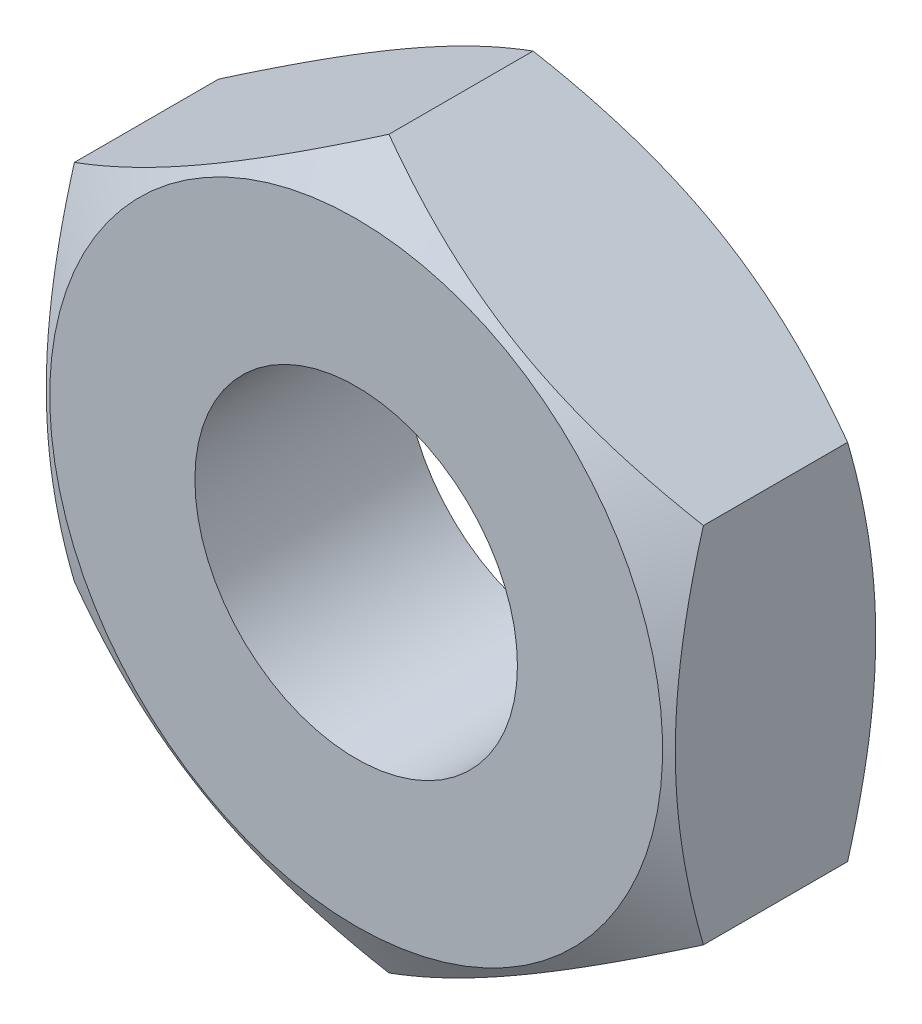
from build123d import *

# Parameters (mm, degrees)
SKETCH1_R      = 1
EXTRUDE1_DEPTH = 1.3


with BuildPart() as part:
    # Sketch1 → Extrude1 (new body)
    with BuildSketch(Plane.XY):
        Polygon((0, 2.25166605), (-1.95, 1.125833025), (-1.95, -1.125833025), (0, -2.25166605), (1.95, -1.125833025), (1.95, 1.125833025), align=None)
        Circle(SKETCH1_R, mode=Mode.SUBTRACT)
    extrude(amount=EXTRUDE1_DEPTH)

    # Sketch2 → Cut-Revolve1 (revolve, cut)
    with BuildSketch(Plane(origin=(0, 0, 0), x_dir=(0, 0, -1), z_dir=(1, 0, 0)), mode=Mode.PRIVATE) as cut_revolve1_sk:
        Polygon((-1.3, 1.9), (-0.865098791, 2.65327099), (-1.3, 2.65327099), align=None)
        Polygon((-0.434901209, 2.65327099), (0, 1.9), (0, 2.65327099), align=None)
    revolve(cut_revolve1_sk.sketch.rotate(Axis((0, 0, 1.3), (0, 0, -1)), 180), axis=Axis((0, 0, 1.3), (0, 0, -1)), mode=Mode.SUBTRACT)


solid = part.part
